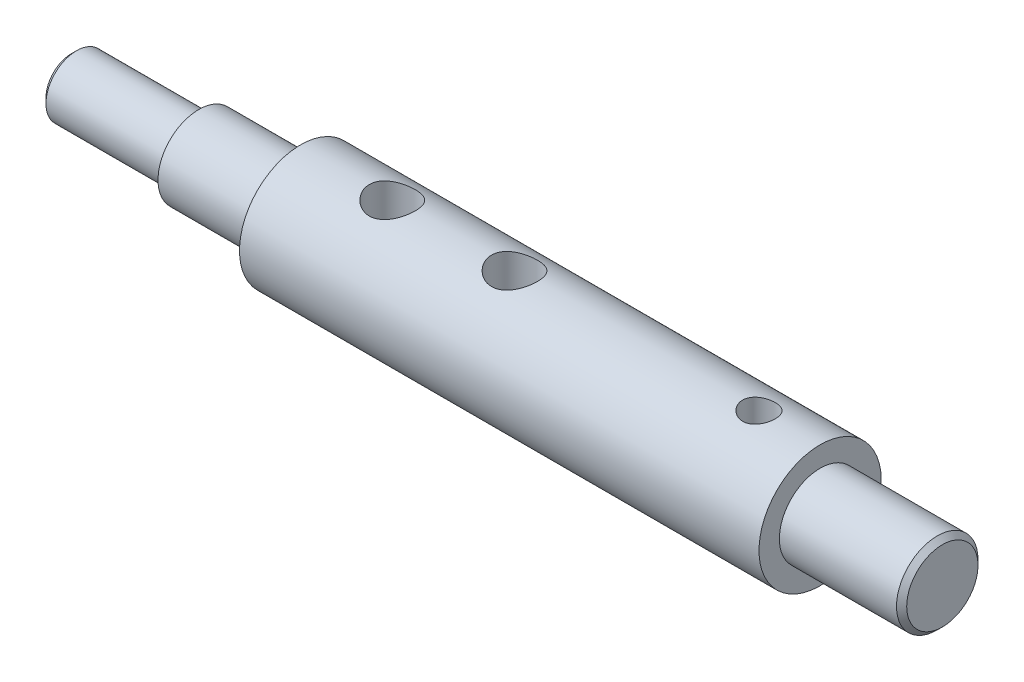
from build123d import *

# Parameters (mm, degrees)
CHAFL_N1_SIZE                = 0.5
TALADRO_DE_MARGEN_PARA_M41_D = 4.5
TALADRO_DE_MARGEN_PARA_M31_D = 3.2


with BuildPart() as part:
    # Croquis1 → Revolución1 (revolve)
    with BuildSketch(Plane(origin=(0, 0, 0), x_dir=(-1, 0, 0), z_dir=(0, 1, 0)), mode=Mode.PRIVATE) as revoluci_n1_sk:
        Polygon((-42.75, 0), (42.75, 0), (42.75, 3), (30.25, 3), (30.25, 4), (20.25, 4), (20.25, 6), (-30.75, 6), (-30.75, 4), (-42.75, 4), align=None)
    revolve(revoluci_n1_sk.sketch.rotate(Axis((42.75, 0, 0), (-1, 0, 0)), 180), axis=Axis((42.75, 0, 0), (-1, 0, 0)))

    # Chaflán1
    chafl_n1_edges = [part.edges().sort_by_distance(p)[0] for p in [
        (-42.75, 0, 3),
        (42.75, 0, 4),
    ]]
    chamfer(chafl_n1_edges, length=CHAFL_N1_SIZE)

    # Taladro de margen para M41 (through all)
    with Locations(Plane(origin=(0, 10, 0), x_dir=(-1, 0, 0), z_dir=(0, 1, 0))):
        with Locations((11.25, 0), (-0.75, 0)):
            Hole(TALADRO_DE_MARGEN_PARA_M41_D / 2)

    # Taladro de margen para M31 (through all)
    with Locations(Plane(origin=(0, 10, 0), x_dir=(-1, 0, 0), z_dir=(0, 1, 0))):
        with Locations((-24.75, 0)):
            Hole(TALADRO_DE_MARGEN_PARA_M31_D / 2)


solid = part.part
